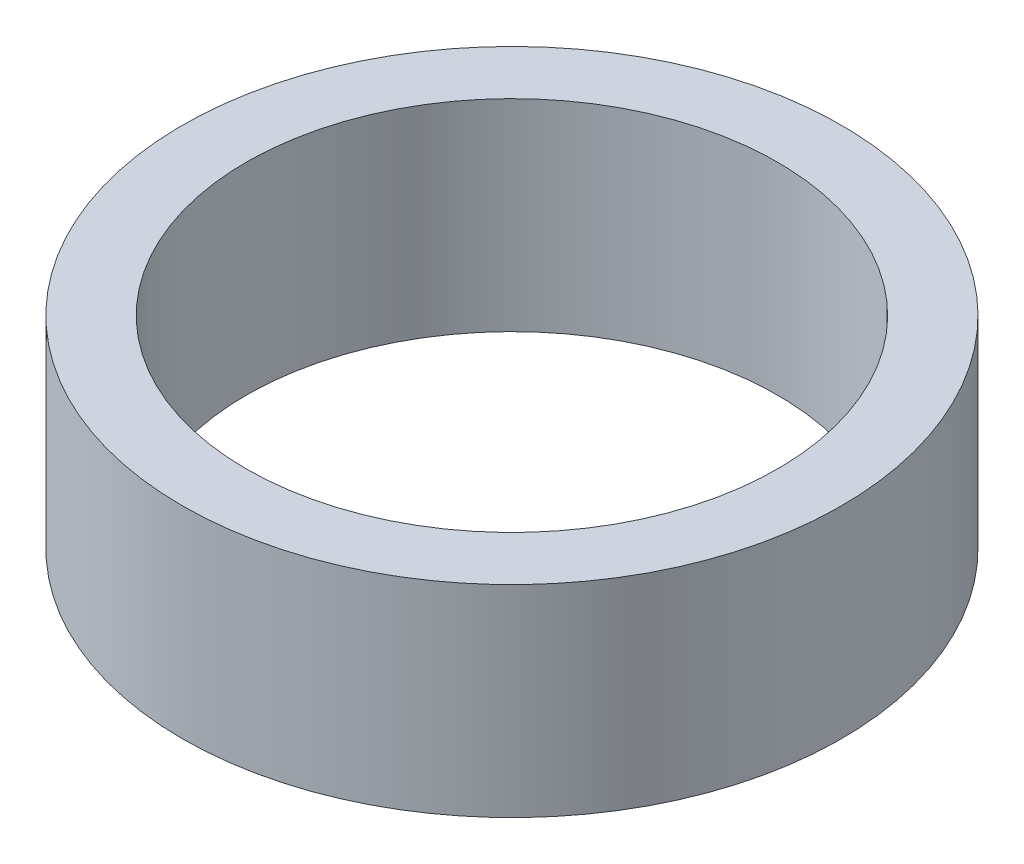
from build123d import *

# Parameters (mm, degrees)
SKETCH1_R           = 4.9
SKETCH1_R_2         = 3.95
BOSS_EXTRUDE2_DEPTH = 3


with BuildPart() as part:
    # Sketch1 → Boss-Extrude2 (new body)
    with BuildSketch(Plane(origin=(0, 0, 0), x_dir=(1, 0, 0), z_dir=(0, 1, 0))):
        with Locations(Location((0, 0, 0), (0, 0, 270))):
            Circle(SKETCH1_R)
        with Locations(Location((0, 0, 0), (0, 0, 270))):
            Circle(SKETCH1_R_2, mode=Mode.SUBTRACT)
    extrude(amount=BOSS_EXTRUDE2_DEPTH)


solid = part.part
